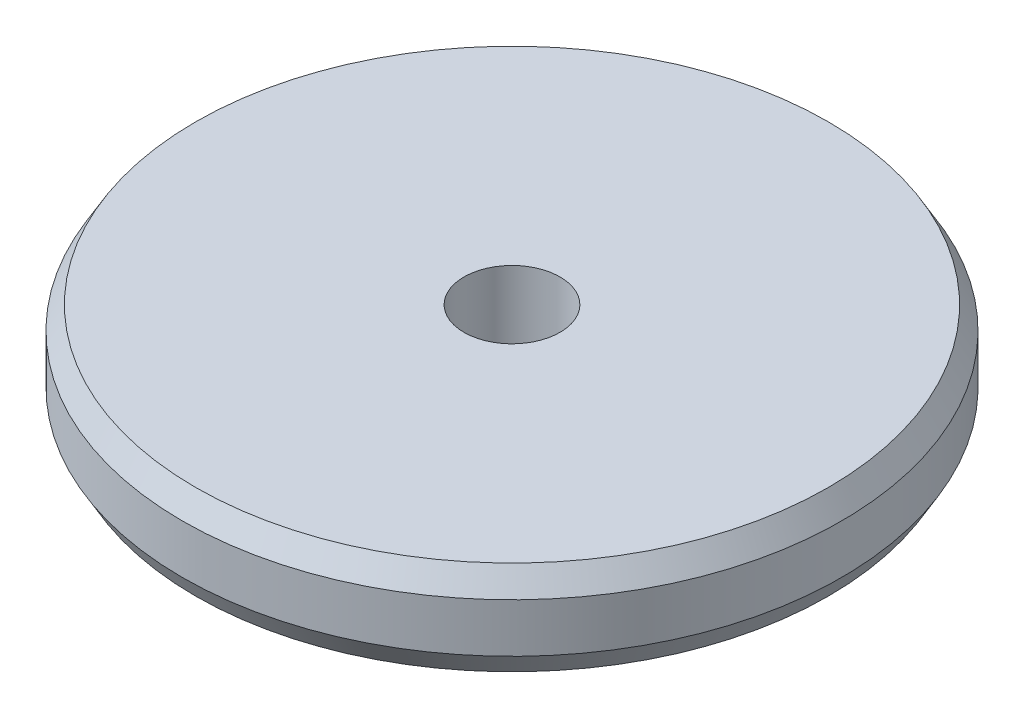
from build123d import *

# Parameters (mm, degrees)
SKETCH_1_R               = 17.5
EXTRUDE_1_DEPTH          = 5
CUT_EXTRUDE_1_DEPTH      = 26.248762346
CUT_EXTRUDE_1_DEPTH_BACK = 26.248762346
SKETCH_2_R               = 2.55
CHAMFER_1_SIZE           = 1.2
CHAMFER_1_SIZE2          = 0.692820323


with BuildPart() as part:
    # 스케치1 → 보스-돌출1 (new body)
    with BuildSketch(Plane(origin=(0, 0, 0), x_dir=(1, 0, 0), z_dir=(0, 1, 0))):
        with Locations(Location((0, 0, 0), (0, 0, 270))):
            Circle(SKETCH_1_R)
    extrude(amount=EXTRUDE_1_DEPTH)

    # 스케치2 → 컷-돌출1 (cut, two sides: drawn at the far end of the back side and taken through both)
    with BuildSketch(Plane(origin=(0, 5, 0), x_dir=(1, 0, 0), z_dir=(0, 1, 0)).offset(-CUT_EXTRUDE_1_DEPTH_BACK)):
        with Locations(Location((0, 0, 0), (0, 0, 270))):
            Circle(SKETCH_2_R)
    extrude(amount=CUT_EXTRUDE_1_DEPTH + CUT_EXTRUDE_1_DEPTH_BACK, mode=Mode.SUBTRACT)

    # 모따기1
    chamfer_1_edges = [part.edges().sort_by_distance(p)[0] for p in [
        (0, 0, -17.5),
        (0, 5, -17.5),
    ]]
    chamfer_1_side = [part.faces().sort_by_distance(p)[0] for p in [
        (0, 2.5, -17.5),
    ]]
    chamfer(chamfer_1_edges, length=CHAMFER_1_SIZE, length2=CHAMFER_1_SIZE2, reference=chamfer_1_side[0])


solid = part.part
